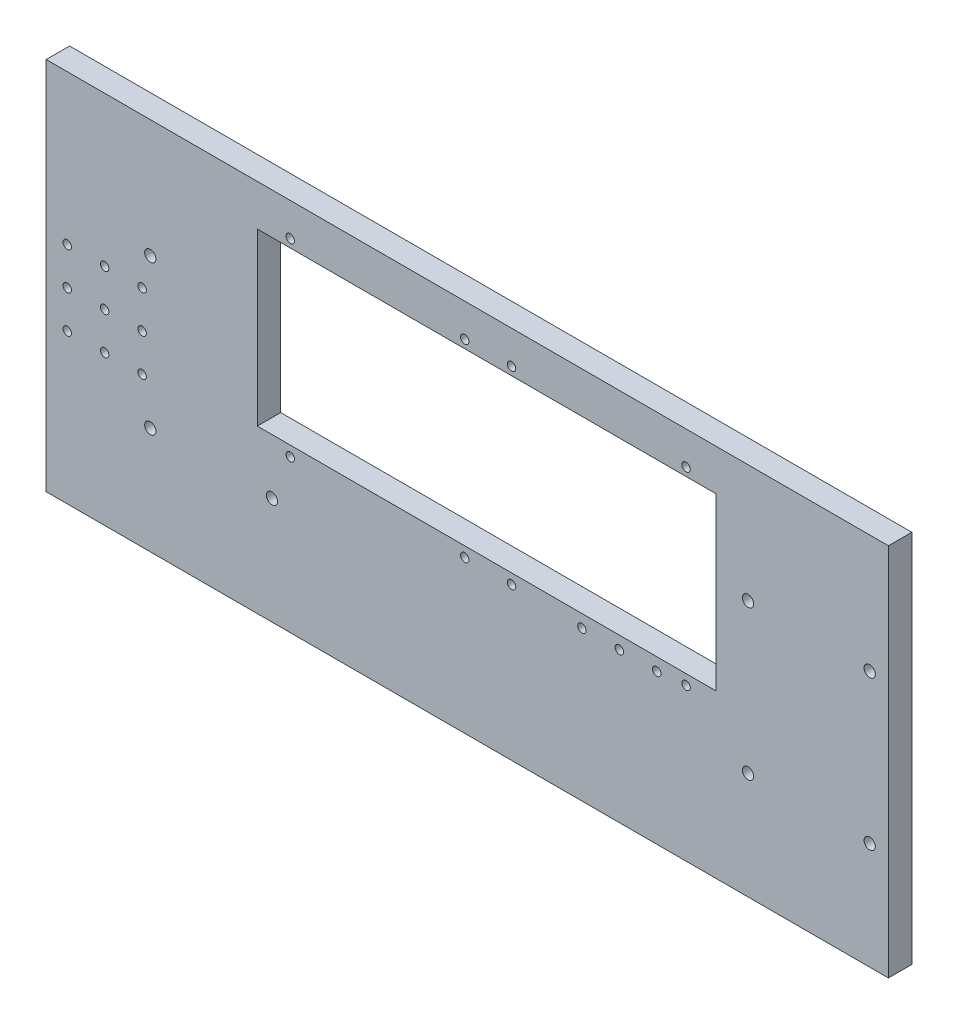
from build123d import *

# Parameters (mm, degrees)
ESQUISSE1_W             = 180
ESQUISSE1_H             = 80
BOSS_EXTRU_1_DEPTH      = 5
ESQUISSE2_R             = 0.9
ENL_V_MAT_EXTRU_1_DEPTH = 5
ESQUISSE4_R             = 0.9
ENL_V_MAT_EXTRU_2_DEPTH = 99.615414617
ESQUISSE5_R             = 1.2
ENL_V_MAT_EXTRU_3_DEPTH = 99.615414617
ESQUISSE6_W             = 98.043134308
ESQUISSE6_H             = 36.477445857
ENL_V_MAT_EXTRU_4_DEPTH = 99.615414617


with BuildPart() as part:
    # Esquisse1 → Boss.-Extru.1 (new body)
    with BuildSketch(Plane.XY):
        Rectangle(ESQUISSE1_W, ESQUISSE1_H)
    extrude(amount=BOSS_EXTRU_1_DEPTH)

    # Esquisse2 → Enlèv. mat.-Extru.1 (cut)
    with BuildSketch(Plane(origin=(0, 0, 0), x_dir=(-1, 0, 0), z_dir=(0, 0, -1))):
        with Locations((-46.756409802, 32.95183049)):
            Circle(ESQUISSE2_R)
        with Locations((-9.456409802, 32.95183049)):
            Circle(ESQUISSE2_R)
        with Locations((0.543590198, 32.95183049)):
            Circle(ESQUISSE2_R)
        with Locations((37.843590198, 32.95183049)):
            Circle(ESQUISSE2_R)
        with Locations((-46.756409802, 12.75183049)):
            Circle(ESQUISSE2_R)
        with Locations((-9.456409802, 12.75183049)):
            Circle(ESQUISSE2_R)
        with Locations((0.543590198, 12.75183049)):
            Circle(ESQUISSE2_R)
        with Locations((37.843590198, 12.75183049)):
            Circle(ESQUISSE2_R)
        with Locations((-46.756409802, -7.44816951)):
            Circle(ESQUISSE2_R)
        with Locations((-9.456409802, -7.44816951)):
            Circle(ESQUISSE2_R)
        with Locations((0.543590198, -7.44816951)):
            Circle(ESQUISSE2_R)
        with Locations((37.843590198, -7.44816951)):
            Circle(ESQUISSE2_R)
    extrude(amount=-ENL_V_MAT_EXTRU_1_DEPTH, mode=Mode.SUBTRACT)

    # Esquisse4 → Enlèv. mat.-Extru.2 (cut, through all)
    with BuildSketch(Plane(origin=(0, 0, 0), x_dir=(-1, 0, 0), z_dir=(0, 0, -1))):
        with Locations((85.5, 0)):
            Circle(ESQUISSE4_R)
        with Locations((77.5, 0)):
            Circle(ESQUISSE4_R)
        with Locations((69.5, 0)):
            Circle(ESQUISSE4_R)
        with Locations((77.5, 8)):
            Circle(ESQUISSE4_R)
        with Locations((69.5, 8)):
            Circle(ESQUISSE4_R)
        with Locations((85.5, 8)):
            Circle(ESQUISSE4_R)
        with Locations((69.5, -8)):
            Circle(ESQUISSE4_R)
        with Locations((77.5, -8)):
            Circle(ESQUISSE4_R)
        with Locations((85.5, -8)):
            Circle(ESQUISSE4_R)
        with Locations((-24.5, 0)):
            Circle(ESQUISSE4_R)
        with Locations((-32.5, 0)):
            Circle(ESQUISSE4_R)
        with Locations((-40.5, 0)):
            Circle(ESQUISSE4_R)
        with Locations((-32.5, 8)):
            Circle(ESQUISSE4_R)
        with Locations((-40.5, 8)):
            Circle(ESQUISSE4_R)
        with Locations((-24.5, 8)):
            Circle(ESQUISSE4_R)
        with Locations((-40.5, -8)):
            Circle(ESQUISSE4_R)
        with Locations((-32.5, -8)):
            Circle(ESQUISSE4_R)
        with Locations((-24.5, -8)):
            Circle(ESQUISSE4_R)
    extrude(amount=-ENL_V_MAT_EXTRU_2_DEPTH, mode=Mode.SUBTRACT)

    # Esquisse5 → Enlèv. mat.-Extru.3 (cut, through all)
    with BuildSketch(Plane(origin=(0, 0, 0), x_dir=(-1, 0, 0), z_dir=(0, 0, -1))):
        with Locations((-60, 14.8)):
            Circle(ESQUISSE5_R)
        with Locations((-86, 14.8)):
            Circle(ESQUISSE5_R)
        with Locations(Location((-86, -17.1, 0), (0, 0, 180))):
            Circle(ESQUISSE5_R)
        with Locations(Location((-60, -17.1, 0), (0, 0, 180))):
            Circle(ESQUISSE5_R)
        with Locations((67.75, 14.8)):
            Circle(ESQUISSE5_R)
        with Locations((41.75, 14.8)):
            Circle(ESQUISSE5_R)
        with Locations(Location((41.75, -17.1, 0), (0, 0, 180))):
            Circle(ESQUISSE5_R)
        with Locations(Location((67.75, -17.1, 0), (0, 0, 180))):
            Circle(ESQUISSE5_R)
    extrude(amount=-ENL_V_MAT_EXTRU_3_DEPTH, mode=Mode.SUBTRACT)

    # Esquisse6 → Enlèv. mat.-Extru.4 (cut, through all)
    with BuildSketch(Plane(origin=(0, 0, 0), x_dir=(-1, 0, 0), z_dir=(0, 0, -1))):
        with Locations((-4.148056784, 12.955156499)):
            Rectangle(ESQUISSE6_W, ESQUISSE6_H)
    extrude(amount=-ENL_V_MAT_EXTRU_4_DEPTH, mode=Mode.SUBTRACT)


solid = part.part
